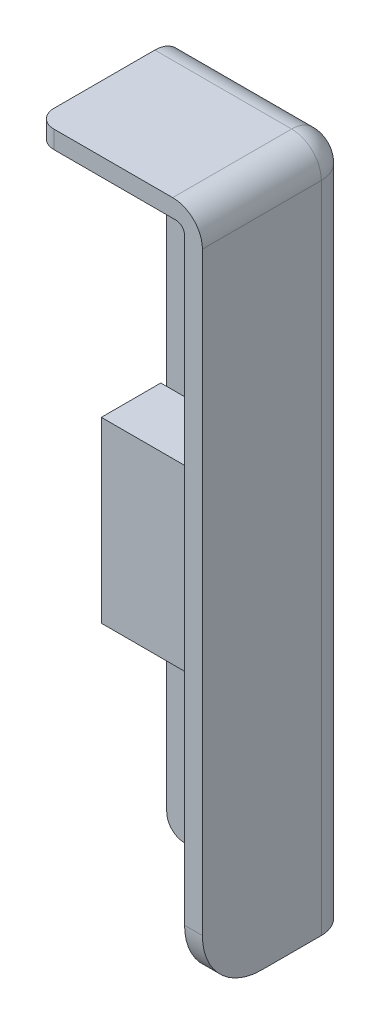
from build123d import *

# Parameters (mm, degrees)
SKETCH1_W                 = 25
SKETCH1_H                 = 115
BOSS_EXTRUDE1_DEPTH       = 14
SKETCH3_W                 = 22
SKETCH3_H                 = 112
CUT_EXTRUDE1_DEPTH        = 25
SKETCH4_W                 = 10
SKETCH4_H                 = 30
BOSS_EXTRUDE2_DEPTH       = 20
F_2_CLEARANCE_HOLE1_D     = 2.2606
F_2_CLEARANCE_HOLE1_DEPTH = 6.35
F_2_CLEARANCE_HOLE1_TIP   = 0.679152758
FILLET1_R                 = 1.5
FILLET3_R                 = 5
FILLET4_R                 = 10
FILLET5_R                 = 3
FILLET6_R                 = 3
SKETCH7_R                 = 2.5
BOSS_EXTRUDE3_DEPTH       = 8
FILLET7_R                 = 1


with BuildPart() as part:
    # Sketch1 → Boss-Extrude1 (new, symmetric)
    with BuildSketch(Plane(origin=(0, 0, 0), x_dir=(0, 0, -1), z_dir=(1, 0, 0))):
        Rectangle(SKETCH1_W, SKETCH1_H)
    extrude(amount=BOSS_EXTRUDE1_DEPTH, both=True)

    # Sketch3 → Cut-Extrude1 (cut)
    with BuildSketch(Plane(origin=(-14, 0, 0), x_dir=(0, 0, -1), z_dir=(1, 0, 0))):
        with Locations((-1.5, -1.5)):
            Rectangle(SKETCH3_W, SKETCH3_H)
    extrude(amount=CUT_EXTRUDE1_DEPTH, mode=Mode.SUBTRACT)

    # Sketch4 → Boss-Extrude2 (add)
    with BuildSketch(Plane.ZY.offset(-11)):
        with Locations((1.5, -1.5)):
            Rectangle(SKETCH4_W, SKETCH4_H)
    extrude(amount=BOSS_EXTRUDE2_DEPTH)

    # #2 Clearance Hole1
    with Locations(Plane.ZY.offset(9)):
        with Locations((1.5, 8.5), (1.5, -11.5)):
            Hole(F_2_CLEARANCE_HOLE1_D / 2, depth=F_2_CLEARANCE_HOLE1_DEPTH)
            with Locations((0, 0, -(F_2_CLEARANCE_HOLE1_DEPTH + F_2_CLEARANCE_HOLE1_TIP / 2))):  # 118° drill point
                Cone(0, F_2_CLEARANCE_HOLE1_D / 2, F_2_CLEARANCE_HOLE1_TIP, mode=Mode.SUBTRACT)

    # Fillet1
    fillet1_edges = [part.edges().sort_by_distance(p)[0] for p in [
        (-1.5, 54.5, -9.5),
        (11, 54.5, 1.5),
        (11, -1.5, -9.5),
    ]]
    fillet(fillet1_edges, radius=FILLET1_R)

    # Fillet3
    fillet3_edges = [part.edges().sort_by_distance(p)[0] for p in [
        (14, 0, -12.5),
        (0, 57.5, -12.5),
        (14, 57.5, 0),
    ]]
    fillet(fillet3_edges, radius=FILLET3_R)

    # Fillet4
    fillet4_edges = [part.edges().sort_by_distance(p)[0] for p in [
        (12.5, -57.5, 12.5),
    ]]
    fillet(fillet4_edges, radius=FILLET4_R)

    # Fillet5
    fillet5_edges = [part.edges().sort_by_distance(p)[0] for p in [
        (-14, -57.5, -11),
        (-14, 56, 12.5),
    ]]
    fillet(fillet5_edges, radius=FILLET5_R)

    # Fillet6
    fillet6_edges = [part.edges().sort_by_distance(p)[0] for p in [
        (11, -1.5, 6.5),
        (11, 13.5, 1.5),
        (11, -1.5, -3.5),
        (11, -16.5, 1.5),
    ]]
    fillet(fillet6_edges, radius=FILLET6_R)

    # Sketch7 → Boss-Extrude3 (add)
    with BuildSketch(Plane(origin=(14, 0, 0), x_dir=(0, 0, -1), z_dir=(1, 0, 0))):
        with Locations((-1.5, -43)):
            Circle(SKETCH7_R)
    extrude(amount=-BOSS_EXTRUDE3_DEPTH)

    # Fillet7
    fillet7_edges = [part.edges().sort_by_distance(p)[0] for p in [
        (6, -43, 4),
        (11, -43, 4),
    ]]
    fillet(fillet7_edges, radius=FILLET7_R)


solid = part.part
